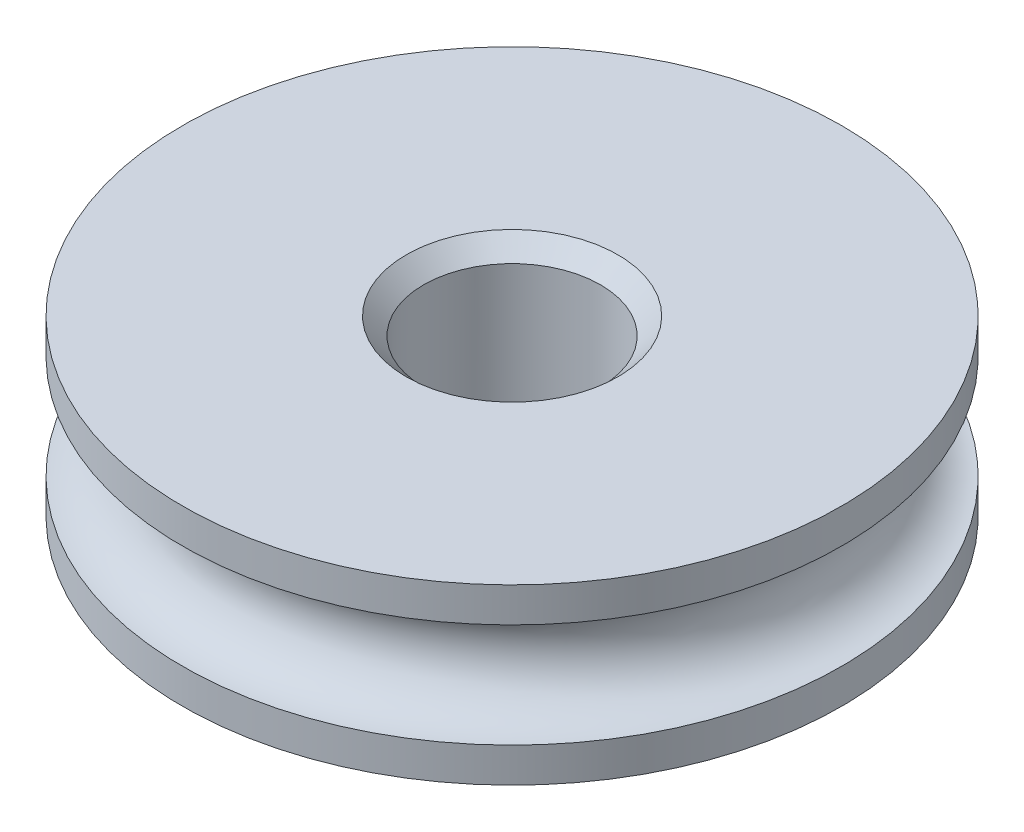
from build123d import *

# Parameters (mm, degrees)
SKETCH2_R          = 6.477
CUT_EXTRUDE1_DEPTH = 37.411588815
CHAMFER1_SIZE      = 1.27


with BuildPart() as part:
    # Sketch1 → Revolve1 (revolve)
    with BuildSketch(Plane(origin=(0, 0, 0), x_dir=(0, 0, -1), z_dir=(1, 0, 0))):
        with BuildLine():
            Line((0, 0), (24.13, 0))
            Line((24.13, 0), (24.13, 2.54))
            ThreePointArc((24.13, 2.54), (20.32, 6.35), (24.13, 10.16))
            Line((24.13, 10.16), (24.13, 12.7))
            Line((24.13, 12.7), (0, 12.7))
            Line((0, 12.7), (0, 0))
        make_face()
    revolve(axis=Axis((0, 0, 0), (0, 1, 0)))

    # Sketch2 → Cut-Extrude1 (cut, through all)
    with BuildSketch(Plane.XZ):
        with Locations(Location((0, 0, 0), (0, 0, 270))):
            Circle(SKETCH2_R)
    extrude(amount=-CUT_EXTRUDE1_DEPTH, mode=Mode.SUBTRACT)

    # Chamfer1
    chamfer1_edges = [part.edges().sort_by_distance(p)[0] for p in [
        (0, 12.7, 6.477),
        (0, 0, 6.477),
    ]]
    chamfer(chamfer1_edges, length=CHAMFER1_SIZE)


solid = part.part
